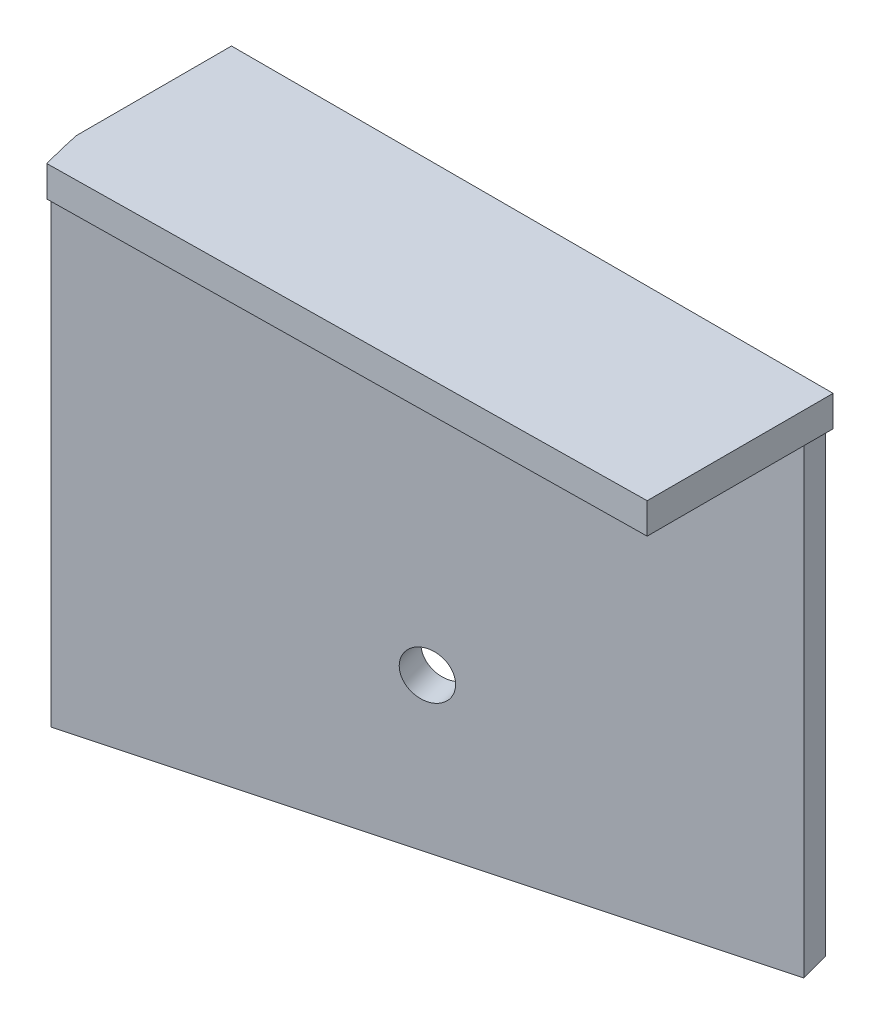
from build123d import *

# Parameters (mm, degrees)
BOSS_EXTRUDE1_DEPTH = 4
BOSS_EXTRUDE3_DEPTH = 60
SKETCH8_R           = 3
CUT_EXTRUDE2_DEPTH  = 79
BOSS_EXTRUDE5_START = -4
BOSS_EXTRUDE5_DEPTH = 4
CUT_EXTRUDE3_DEPTH  = 4
SKETCH14_W          = 38.062003052
SKETCH14_H          = 100
CUT_EXTRUDE4_DEPTH  = 4
CUT_EXTRUDE5_DEPTH  = 10
SKETCH16_W          = 78.309342284
SKETCH16_H          = 4
BOSS_EXTRUDE6_DEPTH = 10
CUT_EXTRUDE6_DEPTH  = 10


with BuildPart() as part:
    # Sketch1 → Boss-Extrude1 (new body)
    with BuildSketch(Plane(origin=(0, 0, 0), x_dir=(1, 0, 0), z_dir=(0, 1, 0))):
        with BuildLine():
            Line((0, 0), (-80, 0))
            ThreePointArc((-80, 0), (-79.31558891, -10.442095378), (-77.274066103, -20.705523608))
            Line((-77.274066103, -20.705523608), (0, 0))
        make_face()
    extrude(amount=BOSS_EXTRUDE1_DEPTH)

    # Sketch7 → Boss-Extrude3 (add)
    with BuildSketch(Plane.XZ):
        Polygon((0, 0), (-77.274066103, 20.705523608), (-78.309342284, 16.841820303), (-1.03527618, -3.863703305), align=None)
    extrude(amount=BOSS_EXTRUDE3_DEPTH)

    # Sketch8 → Cut-Extrude2 (cut)
    with BuildSketch(Plane(origin=(-1.03527618, 0, -3.863703305), x_dir=(-0.9659258262890682, 0, 0.25881904510252124), z_dir=(-0.25881904510252124, 0, -0.9659258262890682))):
        with Locations((40, -40)):
            Circle(SKETCH8_R)
    extrude(amount=-CUT_EXTRUDE2_DEPTH, mode=Mode.SUBTRACT)

    # Sketch11 → Boss-Extrude5 (add)
    with BuildSketch(Plane(origin=(0, 4, 0), x_dir=(1, 0, 0), z_dir=(0, 1, 0)).offset(BOSS_EXTRUDE5_START)):
        with BuildLine():
            Line((0, 0), (-77.274066103, -20.705523608))
            ThreePointArc((-77.274066103, -20.705523608), (-48.700914321, -63.468267223), (0, -80))
            Line((0, -80), (0, 0))
        make_face()
    extrude(amount=BOSS_EXTRUDE5_DEPTH)

    # Sketch12 → Cut-Extrude3 (cut)
    with BuildSketch(Plane.XZ):
        Polygon((-68.830314461, 40.772390306), (32.565775989, 40.772390306), (32.565775989, 109.047215686), (-78.543674294, 109.047215686), align=None)
    extrude(amount=-CUT_EXTRUDE3_DEPTH, mode=Mode.SUBTRACT)

    # Sketch14 → Cut-Extrude4 (cut)
    with BuildSketch(Plane.XZ):
        with Locations((-97.34034381, -33.158179697)):
            Rectangle(SKETCH14_W, SKETCH14_H)
    extrude(amount=-CUT_EXTRUDE4_DEPTH, mode=Mode.SUBTRACT)

    # Sketch15 → Cut-Extrude5 (cut)
    with BuildSketch(Plane(origin=(0, 0, 0), x_dir=(-1, 0, 0), z_dir=(0, -1, 0))):
        Polygon((81.89924148, -21.519578019), (0, -20.386195153), (0, -64.251910572), (85.684715325, -64.251910572), align=None)
    extrude(amount=-CUT_EXTRUDE5_DEPTH, mode=Mode.SUBTRACT)

    # Sketch16 → Boss-Extrude6 (add)
    with BuildSketch(Plane(origin=(0, 0, 0), x_dir=(-1, 0, 0), z_dir=(0, 0, -1))):
        with Locations((39.154671142, 2)):
            Rectangle(SKETCH16_W, SKETCH16_H)
    extrude(amount=BOSS_EXTRUDE6_DEPTH)

    # Sketch17 → Cut-Extrude6 (cut)
    with BuildSketch(Plane(origin=(0, 0, 0), x_dir=(-1, 0, 0), z_dir=(0, -1, 0))):
        Polygon((1.203546953, 3.818615287), (78.309342284, 3.818615287), (78.309342284, 14.954407394), (-14.190924513, 13.37318069), (-14.190924513, 3.818615287), align=None)
    extrude(amount=-CUT_EXTRUDE6_DEPTH, mode=Mode.SUBTRACT)


solid = part.part
